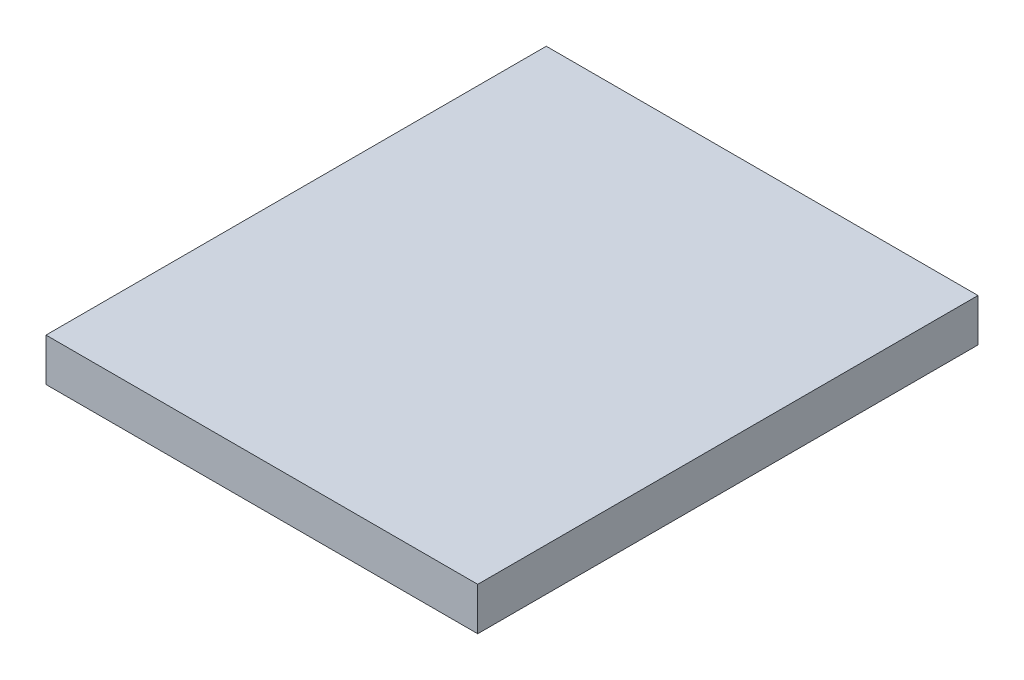
from build123d import *

# Parameters (mm, degrees)
SKETCH1_W           = 63
SKETCH1_H           = 73
BOSS_EXTRUDE1_DEPTH = 6.25
SKETCH2_W           = 2
SKETCH2_H           = 3.25
CUT_EXTRUDE1_DEPTH  = 0.1
SKETCH3_W           = 1.5
SKETCH3_H           = 0.5
CUT_EXTRUDE2_DEPTH  = 0.2


with BuildPart() as part:
    # Sketch1 → Boss-Extrude1 (new body)
    with BuildSketch(Plane(origin=(0, 0, 0), x_dir=(1, 0, 0), z_dir=(0, 1, 0))):
        with Locations((31.5, -36.5)):
            Rectangle(SKETCH1_W, SKETCH1_H)
    extrude(amount=BOSS_EXTRUDE1_DEPTH)

    # Sketch2 → Cut-Extrude1 (cut)
    with BuildSketch(Plane.XY):
        with Locations((56, 3.125)):
            Rectangle(SKETCH2_W, SKETCH2_H)
        with Locations((53.5, 3.125)):
            Rectangle(SKETCH2_W, SKETCH2_H)
        with Locations((51, 3.125)):
            Rectangle(SKETCH2_W, SKETCH2_H)
        with Locations((48.5, 3.125)):
            Rectangle(SKETCH2_W, SKETCH2_H)
        with Locations((46, 3.125)):
            Rectangle(SKETCH2_W, SKETCH2_H)
        with Locations((43.5, 3.125)):
            Rectangle(SKETCH2_W, SKETCH2_H)
    extrude(amount=CUT_EXTRUDE1_DEPTH, mode=Mode.SUBTRACT)

    # Sketch3 → Cut-Extrude2 (cut)
    with BuildSketch(Plane.XY):
        Polygon((55.737279888, 2.358063924), (55.737279888, 2.858063924), (55.237279888, 2.858063924), (55.237279888, 3.358063924), (55.737279888, 3.358063924), (55.737279888, 3.858063924), (56.237279888, 3.858063924), (56.237279888, 3.358063924), (56.737279888, 3.358063924), (56.737279888, 2.858063924), (56.237279888, 2.858063924), (56.237279888, 2.358063924), align=None)
        with Locations((50.97451755, 3.108063924)):
            Rectangle(SKETCH3_W, SKETCH3_H)
    extrude(amount=CUT_EXTRUDE2_DEPTH, mode=Mode.SUBTRACT)


solid = part.part
